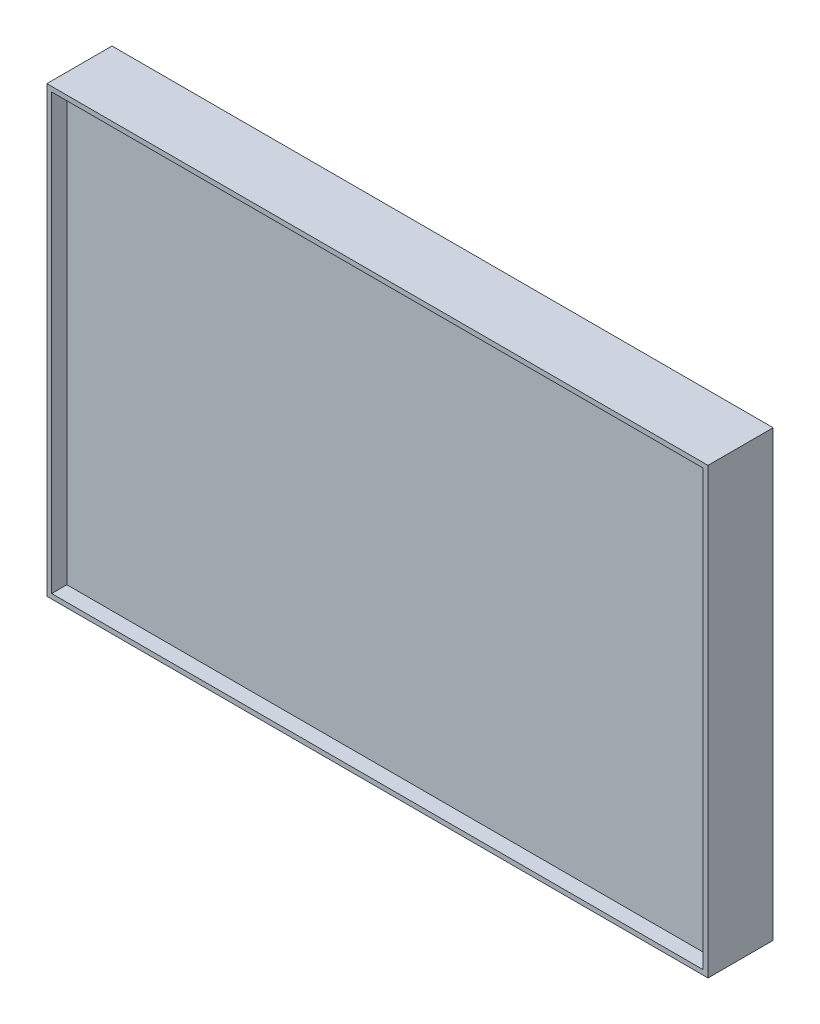
from build123d import *

# Parameters (mm, degrees)
ESQUISSE1_W             = 3044
ESQUISSE1_H             = 2044
BOSS_EXTRU_1_DEPTH      = 300
ESQUISSE2_W             = 3000
ESQUISSE2_H             = 2000
ENL_V_MAT_EXTRU_2_DEPTH = 70


with BuildPart() as part:
    # Esquisse1 → Boss.-Extru.1 (new body)
    with BuildSketch(Plane.XY):
        with Locations((-1719.278911565, 372.340136054)):
            Rectangle(ESQUISSE1_W, ESQUISSE1_H)
    extrude(amount=BOSS_EXTRU_1_DEPTH)

    # Esquisse2 → Enlèv. mat.-Extru.2 (cut)
    with BuildSketch(Plane.XY.offset(300)):
        with Locations((-1719.278911565, 372.340136054)):
            Rectangle(ESQUISSE2_W, ESQUISSE2_H)
    extrude(amount=-ENL_V_MAT_EXTRU_2_DEPTH, mode=Mode.SUBTRACT)


solid = part.part
